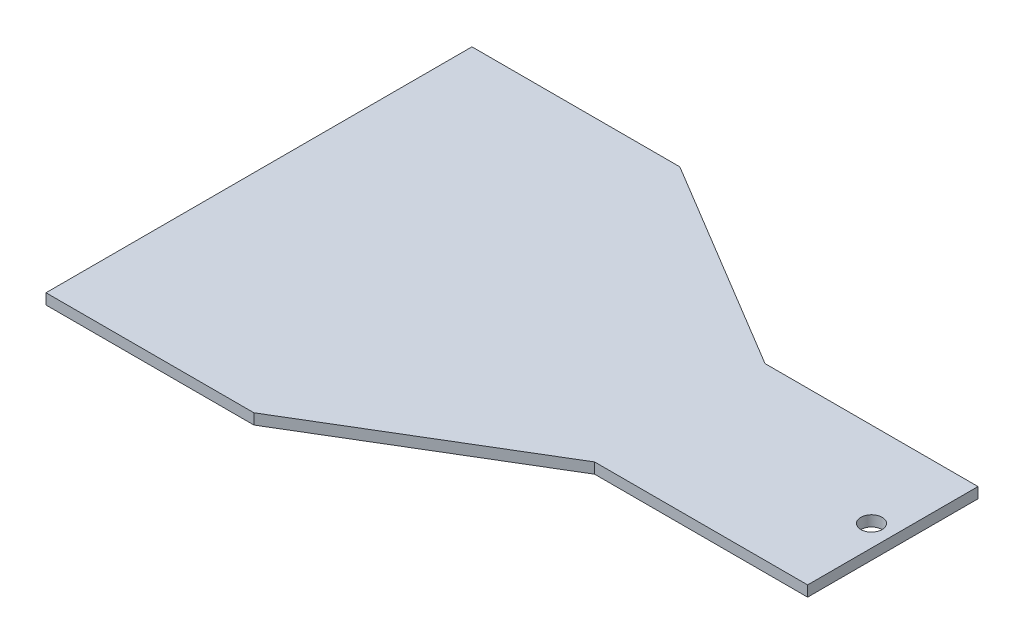
from build123d import *

# Parameters (mm, degrees)
SKETCH1_R           = 3.175
BOSS_EXTRUDE1_DEPTH = 3.175


with BuildPart() as part:
    # Sketch1 → Boss-Extrude1 (new body)
    with BuildSketch(Plane(origin=(0, 0, 0), x_dir=(1, 0, 0), z_dir=(0, 1, 0))):
        Polygon((61.976, 0), (125.476, 38.1), (188.976, 38.1), (188.976, 88.9), (125.476, 88.9), (61.976, 127), (0, 127), (0, 0), align=None)
        with Locations(Location((182.626, 63.5, 0), (0, 0, 270))):
            Circle(SKETCH1_R, mode=Mode.SUBTRACT)
    extrude(amount=BOSS_EXTRUDE1_DEPTH)


solid = part.part
